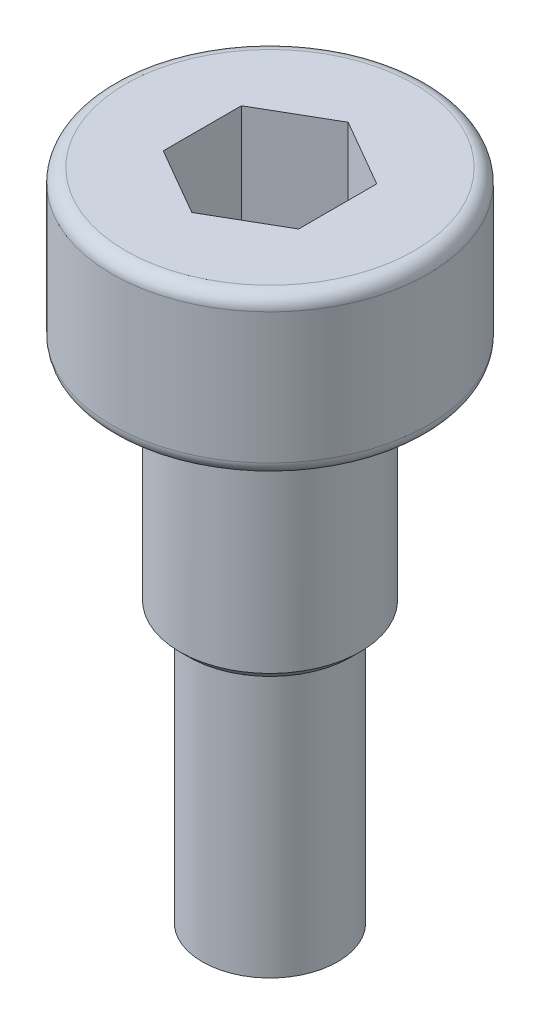
from build123d import *

# Parameters (mm, degrees)
FILLET_1_R          = 0.3
CUT_EXTRUDE_1_DEPTH = 2.4
CHAMFER_1_SIZE      = 0.2


with BuildPart() as part:
    # 草图1 → 旋转1 (revolve)
    with BuildSketch(Plane.XY, mode=Mode.PRIVATE) as revolve_1_sk:
        Polygon((0, 9.61644491), (-3.5, 9.61644491), (-3.5, 6.11644491), (-2, 6.11644491), (-2, 1.11644491), (-1.5, 1.11644491), (-1.5, -4.88355509), (0, -4.88355509), align=None)
    revolve(revolve_1_sk.sketch.rotate(Axis((0, 13.292915498, 0), (0, -1, 0)), 270), axis=Axis((0, 13.292915498, 0), (0, -1, 0)))

    # 圆角1
    fillet_1_edges = [part.edges().sort_by_distance(p)[0] for p in [
        (0, 6.11644491, -3.5),
        (0, 9.61644491, -3.5),
    ]]
    fillet(fillet_1_edges, radius=FILLET_1_R)

    # 草图2 → 切除-拉伸1 (cut)
    with BuildSketch(Plane(origin=(0, 9.61644491, 0), x_dir=(1, 0, 0), z_dir=(0, 1, 0))):
        Polygon((1.5, 0.866025404), (0, 1.732050808), (-1.5, 0.866025404), (-1.5, -0.866025404), (0, -1.732050808), (1.5, -0.866025404), align=None)
    extrude(amount=-CUT_EXTRUDE_1_DEPTH, mode=Mode.SUBTRACT)

    # 倒角1
    chamfer_1_edges = [part.edges().sort_by_distance(p)[0] for p in [
        (0, 1.11644491, -2),
    ]]
    chamfer(chamfer_1_edges, length=CHAMFER_1_SIZE)


solid = part.part
